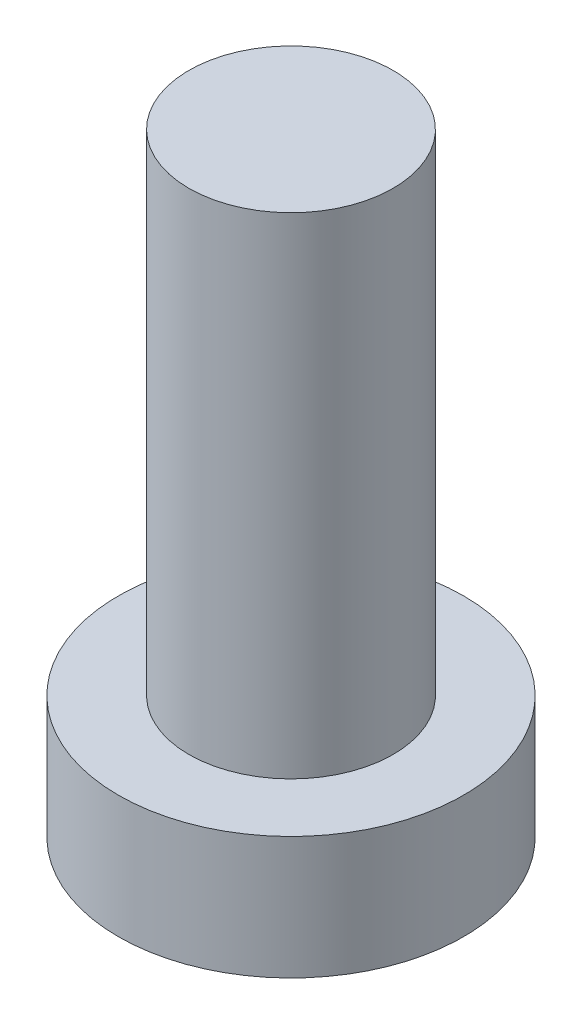
from build123d import *

# Parameters (mm, degrees)
SKETCH1_R           = 4.225
SKETCH1_R_2         = 2.5
BOSS_EXTRUDE1_DEPTH = 3
SKETCH1_2_R         = 2.5
BOSS_EXTRUDE2_DEPTH = 15


with BuildPart() as part:
    # Sketch1 → Boss-Extrude1 (new body)
    with BuildSketch(Plane(origin=(0, 0, 0), x_dir=(1, 0, 0), z_dir=(0, 1, 0))):
        Circle(SKETCH1_R)
        Circle(SKETCH1_R_2, mode=Mode.SUBTRACT)
    extrude(amount=BOSS_EXTRUDE1_DEPTH)

    # Sketch1<2> → Boss-Extrude2 (add)
    with BuildSketch(Plane(origin=(0, 0, 0), x_dir=(1, 0, 0), z_dir=(0, 1, 0))):
        Circle(SKETCH1_2_R)
    extrude(amount=BOSS_EXTRUDE2_DEPTH)


solid = part.part
